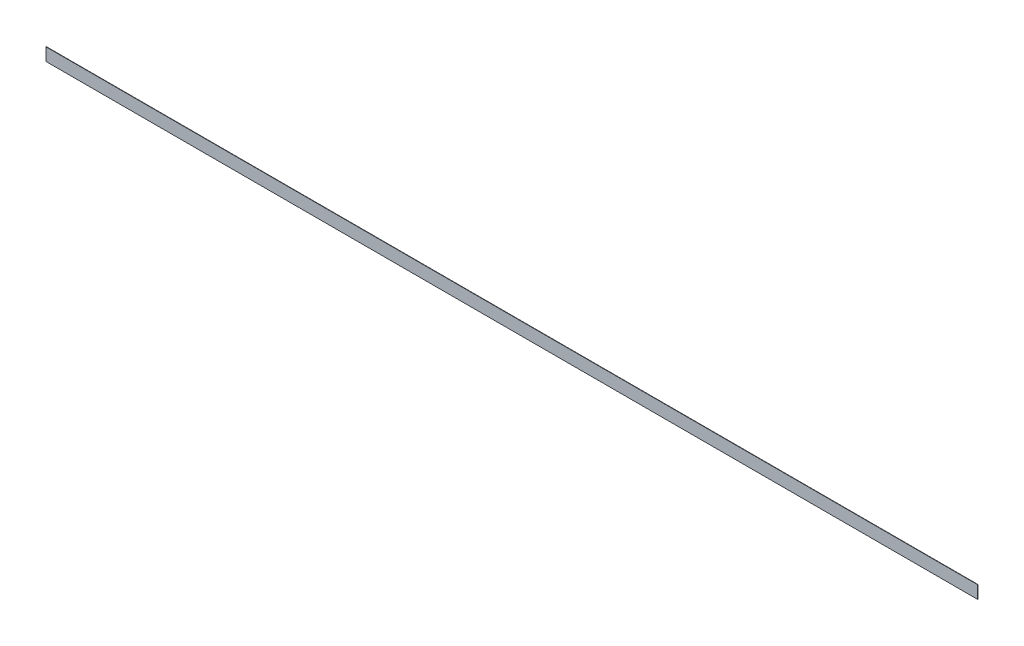
from build123d import *

# Parameters (mm, degrees)
SKETCH1_W           = 750
SKETCH1_H           = 10.25
BOSS_EXTRUDE1_DEPTH = 0.3


with BuildPart() as part:
    # Sketch1 → Boss-Extrude1 (new body)
    with BuildSketch(Plane.XY):
        Rectangle(SKETCH1_W, SKETCH1_H)
    extrude(amount=BOSS_EXTRUDE1_DEPTH)


solid = part.part
